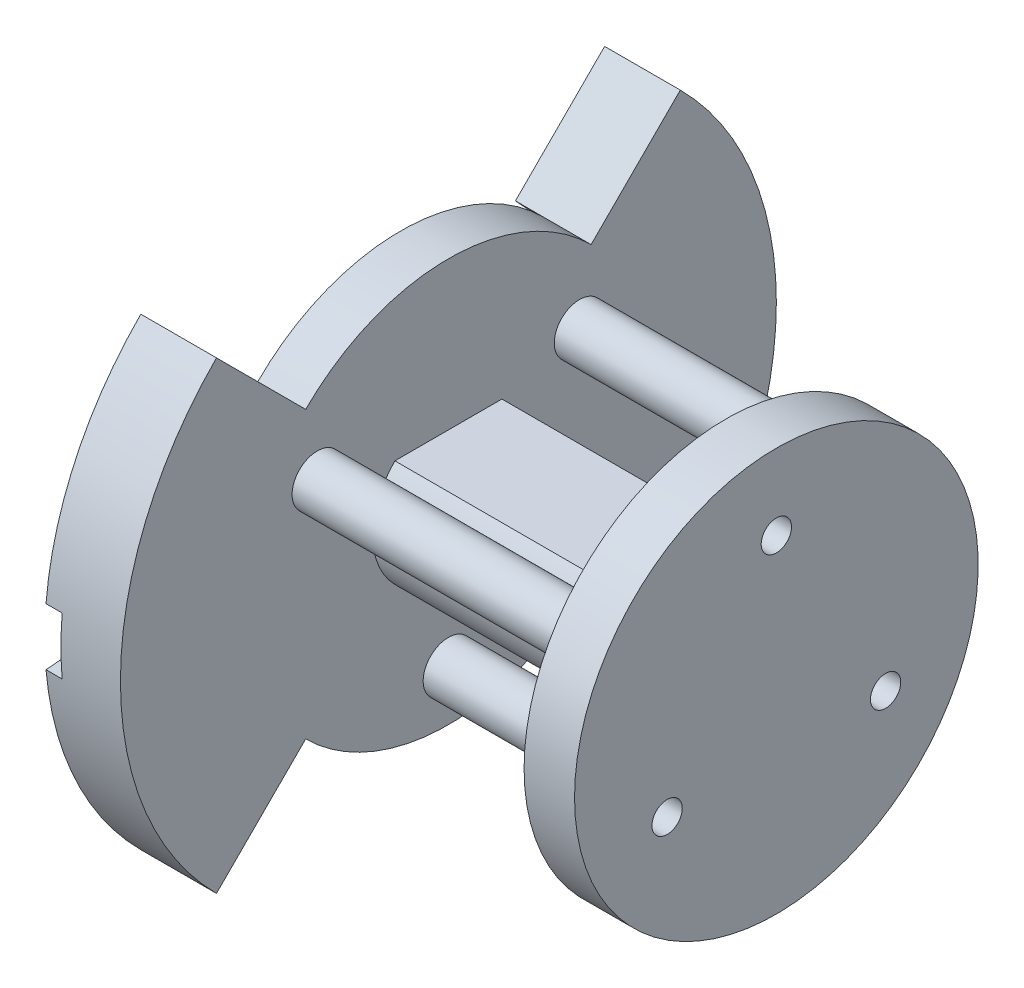
from build123d import *

# Parameters (mm, degrees)
CORTAR_EXTRUIR2_DEPTH   = 7.5
CROQUIS5_R              = 1.5
CORTAR_EXTRUIR4_DEPTH   = 5
CROQUIS6_R              = 2.5
SALIENTE_EXTRUIR1_DEPTH = 32.5
CORTAR_EXTRUIR5_DEPTH   = 5
CORTAR_EXTRUIR12_DEPTH  = 2.5
CORTAR_EXTRUIR13_START  = 27.5
CORTAR_EXTRUIR13_DEPTH  = 27.5
CORTAR_EXTRUIR14_DEPTH  = 1.6


with BuildPart() as part:
    # Croquis1 → Revolución1 (revolve)
    with BuildSketch(Plane(origin=(0, 0, 0), x_dir=(1, 0, 0), z_dir=(0, 1, 0)), mode=Mode.PRIVATE) as revoluci_n1_sk:
        Polygon((0, 0), (40, 0), (40, 20), (35, 20), (35, 7.5), (7.5, 7.5), (7.5, 32.5), (0, 32.5), (0, 20), (2.75, 20), (2.75, 10), (0, 10), align=None)
    revolve(revoluci_n1_sk.sketch.rotate(Axis((0, 0, 0), (1, 0, 0)), 180), axis=Axis((0, 0, 0), (1, 0, 0)))

    # Croquis2 → Cortar-Extruir2 (cut)
    with BuildSketch(Plane.ZY):
        with BuildLine():
            ThreePointArc((-14.142135624, 14.142135624), (0, 20), (14.142135624, 14.142135624))
            Line((14.142135624, 14.142135624), (22.980970389, 22.980970389))
            ThreePointArc((22.980970389, 22.980970389), (0, 32.5), (-22.980970389, 22.980970389))
            Line((-22.980970389, 22.980970389), (-14.142135624, 14.142135624))
        make_face()
        with BuildLine():
            Line((22.980970389, -22.980970389), (14.142135624, -14.142135624))
            ThreePointArc((14.142135624, -14.142135624), (0, -20), (-14.142135624, -14.142135624))
            Line((-14.142135624, -14.142135624), (-22.980970389, -22.980970389))
            ThreePointArc((-22.980970389, -22.980970389), (0, -32.5), (22.980970389, -22.980970389))
        make_face()
    extrude(amount=-CORTAR_EXTRUIR2_DEPTH, mode=Mode.SUBTRACT)

    # Croquis5 → Cortar-Extruir4 (cut)
    with BuildSketch(Plane(origin=(40, 0, 0), x_dir=(0, 0, -1), z_dir=(1, 0, 0))):
        with Locations((0, 12.5)):
            Circle(CROQUIS5_R)
        with Locations((10.825317547, -6.25)):
            Circle(CROQUIS5_R)
        with Locations((-10.825317547, -6.25)):
            Circle(CROQUIS5_R)
    extrude(amount=-CORTAR_EXTRUIR4_DEPTH, mode=Mode.SUBTRACT)

    # Croquis6 → Saliente-Extruir1 (add)
    with BuildSketch(Plane(origin=(40, 0, 0), x_dir=(0, 0, -1), z_dir=(1, 0, 0))):
        with Locations((0, -15)):
            Circle(CROQUIS6_R)
        with Locations((-12.990381057, 7.5)):
            Circle(CROQUIS6_R)
        with Locations((12.990381057, 7.5)):
            Circle(CROQUIS6_R)
    extrude(amount=-SALIENTE_EXTRUIR1_DEPTH)

    # Croquis7 → Cortar-Extruir5 (cut)
    with BuildSketch(Plane.ZY):
        with BuildLine():
            Line((-0.23528257, 1.885375854), (-0.796607872, 3.057943083))
            ThreePointArc((-0.796607872, 3.057943083), (-0.979134174, 3.319175723), (-1.21, 3.538855747))
            ThreePointArc((-1.21, 3.538855747), (-1.431236037, 3.455309452), (-1.646749691, 3.357948102))
            ThreePointArc((-1.646749691, 3.357948102), (-1.654659248, 3.039364075), (-1.599005463, 2.725579118))
            Line((-1.599005463, 2.725579118), (-1.166792151, 1.499531952))
            ThreePointArc((-1.166792151, 1.499531952), (-1.343502884, 1.343502884), (-1.499531952, 1.166792151))
            Line((-1.499531952, 1.166792151), (-2.725579118, 1.599005463))
            ThreePointArc((-2.725579118, 1.599005463), (-3.039364075, 1.654659248), (-3.357948102, 1.646749691))
            ThreePointArc((-3.357948102, 1.646749691), (-3.455309452, 1.431236037), (-3.538855747, 1.21))
            ThreePointArc((-3.538855747, 1.21), (-3.319175723, 0.979134174), (-3.057943083, 0.796607872))
            Line((-3.057943083, 0.796607872), (-1.885375854, 0.23528257))
            ThreePointArc((-1.885375854, 0.23528257), (-1.9, 0), (-1.885375854, -0.23528257))
            Line((-1.885375854, -0.23528257), (-3.057943083, -0.796607872))
            ThreePointArc((-3.057943083, -0.796607872), (-3.319175723, -0.979134174), (-3.538855747, -1.21))
            ThreePointArc((-3.538855747, -1.21), (-3.455309452, -1.431236037), (-3.357948102, -1.646749691))
            ThreePointArc((-3.357948102, -1.646749691), (-3.039364075, -1.654659248), (-2.725579118, -1.599005463))
            Line((-2.725579118, -1.599005463), (-1.499531952, -1.166792151))
            ThreePointArc((-1.499531952, -1.166792151), (-1.343502884, -1.343502884), (-1.166792151, -1.499531952))
            Line((-1.166792151, -1.499531952), (-1.599005463, -2.725579118))
            ThreePointArc((-1.599005463, -2.725579118), (-1.654659248, -3.039364075), (-1.646749691, -3.357948102))
            ThreePointArc((-1.646749691, -3.357948102), (-1.431236037, -3.455309452), (-1.21, -3.538855747))
            ThreePointArc((-1.21, -3.538855747), (-0.979134174, -3.319175723), (-0.796607872, -3.057943083))
            Line((-0.796607872, -3.057943083), (-0.23528257, -1.885375854))
            ThreePointArc((-0.23528257, -1.885375854), (0, -1.9), (0.23528257, -1.885375854))
            Line((0.23528257, -1.885375854), (0.796607872, -3.057943083))
            ThreePointArc((0.796607872, -3.057943083), (0.979134174, -3.319175723), (1.21, -3.538855747))
            ThreePointArc((1.21, -3.538855747), (1.431236037, -3.455309452), (1.646749691, -3.357948102))
            ThreePointArc((1.646749691, -3.357948102), (1.654659248, -3.039364075), (1.599005463, -2.725579118))
            Line((1.599005463, -2.725579118), (1.166792151, -1.499531952))
            ThreePointArc((1.166792151, -1.499531952), (1.343502884, -1.343502884), (1.499531952, -1.166792151))
            Line((1.499531952, -1.166792151), (2.725579118, -1.599005463))
            ThreePointArc((2.725579118, -1.599005463), (3.039364075, -1.654659248), (3.357948102, -1.646749691))
            ThreePointArc((3.357948102, -1.646749691), (3.455309452, -1.431236037), (3.538855747, -1.21))
            ThreePointArc((3.538855747, -1.21), (3.319175723, -0.979134174), (3.057943083, -0.796607872))
            Line((3.057943083, -0.796607872), (1.885375854, -0.23528257))
            ThreePointArc((1.885375854, -0.23528257), (1.9, 0), (1.885375854, 0.23528257))
            Line((1.885375854, 0.23528257), (3.057943083, 0.796607872))
            ThreePointArc((3.057943083, 0.796607872), (3.319175723, 0.979134174), (3.538855747, 1.21))
            ThreePointArc((3.538855747, 1.21), (3.455309452, 1.431236037), (3.357948102, 1.646749691))
            ThreePointArc((3.357948102, 1.646749691), (3.039364075, 1.654659248), (2.725579118, 1.599005463))
            Line((2.725579118, 1.599005463), (1.499531952, 1.166792151))
            ThreePointArc((1.499531952, 1.166792151), (1.343502884, 1.343502884), (1.166792151, 1.499531952))
            Line((1.166792151, 1.499531952), (1.599005463, 2.725579118))
            ThreePointArc((1.599005463, 2.725579118), (1.654659248, 3.039364075), (1.646749691, 3.357948102))
            ThreePointArc((1.646749691, 3.357948102), (1.431236037, 3.455309452), (1.21, 3.538855747))
            ThreePointArc((1.21, 3.538855747), (0.979134174, 3.319175723), (0.796607872, 3.057943083))
            Line((0.796607872, 3.057943083), (0.23528257, 1.885375854))
            ThreePointArc((0.23528257, 1.885375854), (0.117868309, 1.896340439), (0, 1.9))
            ThreePointArc((0, 1.9), (-0.117868309, 1.896340439), (-0.23528257, 1.885375854))
        make_face()
    extrude(amount=-CORTAR_EXTRUIR5_DEPTH, mode=Mode.SUBTRACT)

    # Croquis13 → Cortar-Extruir12 (cut)
    with BuildSketch(Plane.ZY):
        with BuildLine():
            ThreePointArc((-31.625, 0), (-27.5, -4.125), (-23.375, 0))
            Line((-23.375, 0), (-31.625, 0))
        make_face()
        with BuildLine():
            Line((-31.625, 0), (-23.375, 0))
            ThreePointArc((-23.375, 0), (-27.5, 4.125), (-31.625, 0))
        make_face()
    extrude(amount=-CORTAR_EXTRUIR12_DEPTH, mode=Mode.SUBTRACT)

    # Croquis14 → Cortar-Extruir13 (cut)
    with BuildSketch(Plane.ZY.offset(-35).offset(CORTAR_EXTRUIR13_START)):
        with BuildLine():
            Line((-5.303300859, 5.303300859), (0, 5.303300859))
            Line((0, 5.303300859), (0, 7.5))
            ThreePointArc((0, 7.5), (-2.870125743, 6.929096494), (-5.303300859, 5.303300859))
        make_face()
        with BuildLine():
            Line((0, 7.5), (0, 5.303300859))
            Line((0, 5.303300859), (5.303300859, 5.303300859))
            ThreePointArc((5.303300859, 5.303300859), (2.870125743, 6.929096494), (0, 7.5))
        make_face()
        with BuildLine():
            Line((5.303300859, -5.303300859), (-5.303300859, -5.303300859))
            ThreePointArc((-5.303300859, -5.303300859), (0, -7.5), (5.303300859, -5.303300859))
        make_face()
    extrude(amount=-CORTAR_EXTRUIR13_DEPTH, mode=Mode.SUBTRACT)

    # Croquis15 → Cortar-Extruir14 (cut)
    with BuildSketch(Plane.ZY):
        with BuildLine():
            ThreePointArc((29, 0), (28.972398426, -1.264962234), (28.889646245, -2.52751654))
            Line((28.889646245, -2.52751654), (32.376327688, -2.832561639))
            ThreePointArc((32.376327688, -2.832561639), (32.469067201, -1.417630089), (32.5, 0))
            ThreePointArc((32.5, 0), (32.469067201, 1.417630089), (32.376327688, 2.832561639))
            Line((32.376327688, 2.832561639), (28.889646245, 2.52751654))
            ThreePointArc((28.889646245, 2.52751654), (28.972398426, 1.264962234), (29, 0))
        make_face()
        with BuildLine():
            ThreePointArc((26, 0), (25.975253761, -1.134104071), (25.90106215, -2.266049311))
            Line((25.90106215, -2.266049311), (28.889646245, -2.52751654))
            ThreePointArc((28.889646245, -2.52751654), (28.972398426, -1.264962234), (29, 0))
            ThreePointArc((29, 0), (28.972398426, 1.264962234), (28.889646245, 2.52751654))
            Line((28.889646245, 2.52751654), (25.90106215, 2.266049311))
            ThreePointArc((25.90106215, 2.266049311), (25.975253761, 1.134104071), (26, 0))
        make_face()
    extrude(amount=-CORTAR_EXTRUIR14_DEPTH, mode=Mode.SUBTRACT)


solid = part.part
